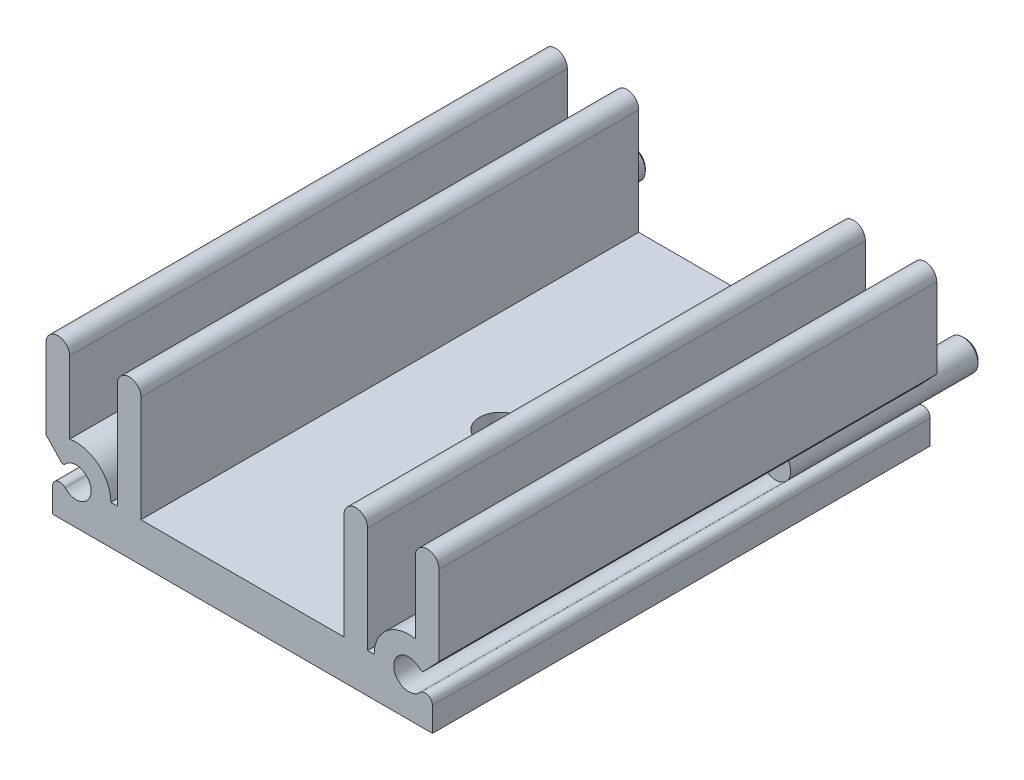
from build123d import *

# Parameters (mm, degrees)
EXTRUDE_1_DEPTH      = 38
CUT_EXTRUDE_1_REACH  = 44.579
SKETCH_2_R           = 1.6
EXTRUDE_2_DEPTH      = 4.5
EXTRUDE_2_DEPTH_BACK = 10
SKETCH_3_R           = 1.15
CHAMFER_1_SIZE       = 0.2


with BuildPart() as part:
    # Эскиз1 → Бобышка-Вытянуть1 (new body)
    with BuildSketch(Plane.XY):
        with BuildLine():
            Line((-14.5, -3), (14.5, -3))
            Line((14.5, -3), (14.5, -1.148611647))
            ThreePointArc((14.5, -1.148611647), (14.150439729, -0.637384409), (13.547219321, -0.777637076))
            ThreePointArc((13.547219321, -0.777637076), (11.55, 0), (13.547219321, 0.777637076))
            ThreePointArc((13.547219321, 0.777637076), (13.692982689, 0.71288454), (13.839750373, 0.775327291))
            Line((13.839750373, 0.775327291), (15, 2))
            Line((15, 2), (15, 8.1))
            ThreePointArc((15, 8.1), (14.1, 9), (13.2, 8.1))
            Line((13.2, 8.1), (13.2, 2.602402736))
            ThreePointArc((13.2, 2.602402736), (11.012175957, 2.042975771), (10.05, 0))
            Line((10.05, 0), (9.55, 0))
            Line((9.55, 0), (9.55, 8.1))
            ThreePointArc((9.55, 8.1), (8.65, 9), (7.75, 8.1))
            Line((7.75, 8.1), (7.75, 0))
            Line((7.75, 0), (-7.75, 0))
            Line((-7.75, 0), (-7.75, 8.1))
            ThreePointArc((-7.75, 8.1), (-8.65, 9), (-9.55, 8.1))
            Line((-9.55, 8.1), (-9.55, 0))
            Line((-9.55, 0), (-10.05, 0))
            ThreePointArc((-10.05, 0), (-11.012175957, 2.042975771), (-13.2, 2.602402736))
            Line((-13.2, 2.602402736), (-13.2, 8.1))
            ThreePointArc((-13.2, 8.1), (-14.1, 9), (-15, 8.1))
            Line((-15, 8.1), (-15, 2))
            Line((-15, 2), (-13.839750373, 0.775327291))
            ThreePointArc((-13.839750373, 0.775327291), (-13.692982689, 0.71288454), (-13.547219321, 0.777637076))
            ThreePointArc((-13.547219321, 0.777637076), (-11.55, 0), (-13.547219321, -0.777637076))
            ThreePointArc((-13.547219321, -0.777637076), (-14.150439729, -0.637384409), (-14.5, -1.148611647))
            Line((-14.5, -1.148611647), (-14.5, -3))
        make_face()
    extrude(amount=EXTRUDE_1_DEPTH)

    # Эскиз2 → Вырез-Вытянуть1 (cut, up to next)
    with BuildSketch(Plane.XZ.offset(3), mode=Mode.PRIVATE) as cut_extrude_1_sk1:
        with Locations(Location((0, 18.3, 0), (0, 0, 270))):
            Circle(SKETCH_2_R)
    cut_extrude_1_tool1 = extrude(cut_extrude_1_sk1.sketch, amount=-CUT_EXTRUDE_1_REACH, mode=Mode.PRIVATE) & part.part
    add(cut_extrude_1_tool1.solids().sort_by_distance((0, -3, 18.3))[0], mode=Mode.SUBTRACT)

    # Эскиз3 → Бобышка-Вытянуть2 (add, two sides: drawn at the far end of the back side and taken through both)
    with BuildSketch(Plane(origin=(0, 0, 0), x_dir=(-1, 0, 0), z_dir=(0, 0, -1)).offset(-EXTRUDE_2_DEPTH_BACK)):
        with Locations((12.7, 0)):
            Circle(SKETCH_3_R)
        with Locations((-12.7, 0)):
            Circle(SKETCH_3_R)
    extrude(amount=EXTRUDE_2_DEPTH + EXTRUDE_2_DEPTH_BACK)

    # Фаска1
    chamfer_1_edges = [part.edges().sort_by_distance(p)[0] for p in [
        (-11.55, 0, -4.5),
        (13.85, 0, -4.5),
    ]]
    chamfer(chamfer_1_edges, length=CHAMFER_1_SIZE)


solid = part.part
